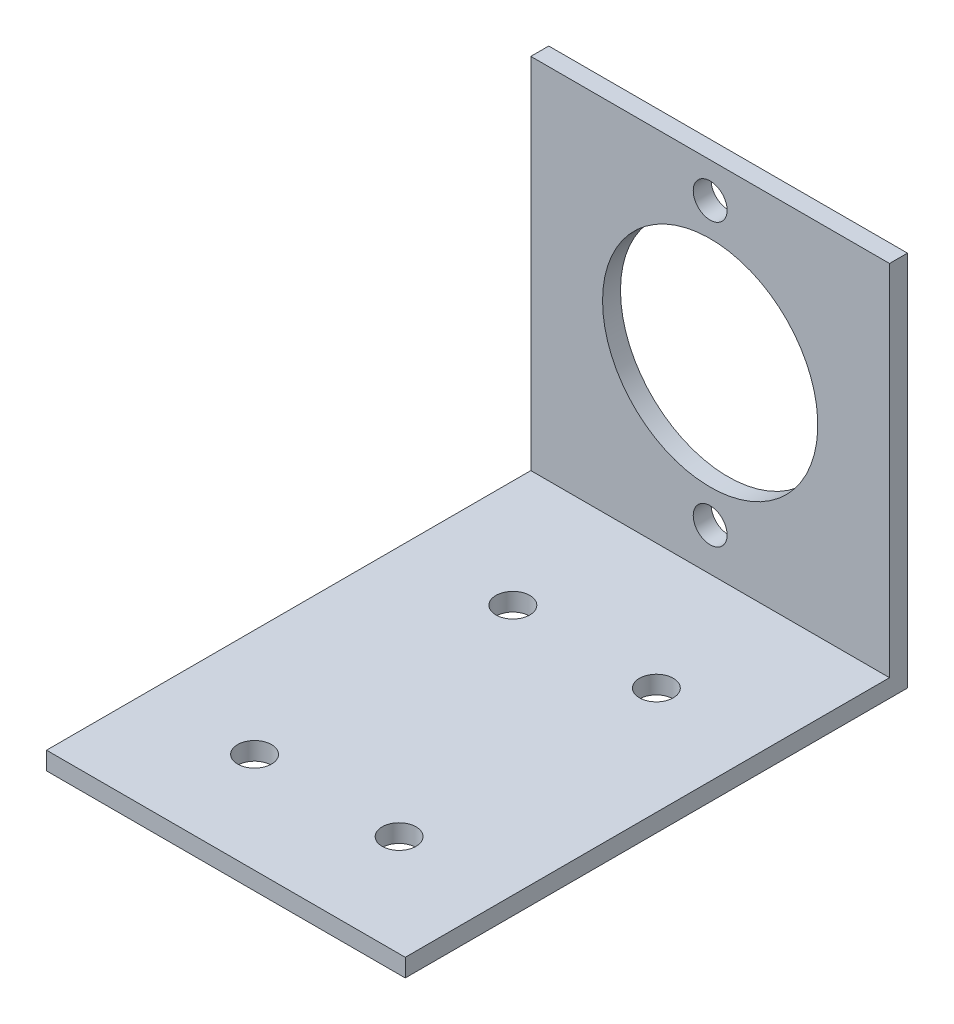
from build123d import *

# Parameters (mm, degrees)
SKETCH1_W                    = 31.75
SKETCH1_H                    = 1.5875
BOSS_EXTRUDE1_DEPTH          = 44.45
SKETCH2_W                    = 31.75
SKETCH2_H                    = 1.5875
BOSS_EXTRUDE2_DEPTH          = 31.75
SKETCH3_R                    = 9.525
CUT_EXTRUDE1_DEPTH           = 64.994170877
F_3_0_3_DIAMETER_HOLE1_D     = 3
F_3_0_3_DIAMETER_HOLE1_DEPTH = 3.556
F_3_0_3_DIAMETER_HOLE1_TIP   = 0.901290929
F_3_0_3_DIAMETER_HOLE2_D     = 3
F_3_0_3_DIAMETER_HOLE2_DEPTH = 3.556
F_3_0_3_DIAMETER_HOLE2_TIP   = 0.901290929


with BuildPart() as part:
    # Sketch1 → Boss-Extrude1 (new body)
    with BuildSketch(Plane.XY):
        with Locations((15.875, 0.79375)):
            Rectangle(SKETCH1_W, SKETCH1_H)
    extrude(amount=BOSS_EXTRUDE1_DEPTH)

    # Sketch2 → Boss-Extrude2 (add)
    with BuildSketch(Plane(origin=(0, 1.5875, 0), x_dir=(1, 0, 0), z_dir=(0, 1, 0))):
        with Locations((15.875, -0.79375)):
            Rectangle(SKETCH2_W, SKETCH2_H)
    extrude(amount=BOSS_EXTRUDE2_DEPTH)

    # Sketch3 → Cut-Extrude1 (cut, through all)
    with BuildSketch(Plane(origin=(0, 0, 0), x_dir=(-1, 0, 0), z_dir=(0, 0, -1))):
        with Locations((-15.875, 17.78)):
            Circle(SKETCH3_R)
    extrude(amount=-CUT_EXTRUDE1_DEPTH, mode=Mode.SUBTRACT)

    # Ø3.0 (3) Diameter Hole1
    with Locations(Plane(origin=(0, 0, 0), x_dir=(-1, 0, 0), z_dir=(0, 0, -1))):
        with Locations((-15.875, 30.226), (-15.875, 5.334)):
            Hole(F_3_0_3_DIAMETER_HOLE1_D / 2, depth=F_3_0_3_DIAMETER_HOLE1_DEPTH)
            with Locations((0, 0, -(F_3_0_3_DIAMETER_HOLE1_DEPTH + F_3_0_3_DIAMETER_HOLE1_TIP / 2))):  # 118° drill point
                Cone(0, F_3_0_3_DIAMETER_HOLE1_D / 2, F_3_0_3_DIAMETER_HOLE1_TIP, mode=Mode.SUBTRACT)

    # Ø3.0 (3) Diameter Hole2
    with Locations(Plane(origin=(0, 1.5875, 0), x_dir=(1, 0, 0), z_dir=(0, 1, 0))):
        with Locations((22.225, -12.7), (22.225, -35.469930371), (9.525, -12.7), (9.525, -35.56)):
            Hole(F_3_0_3_DIAMETER_HOLE2_D / 2, depth=F_3_0_3_DIAMETER_HOLE2_DEPTH)
            with Locations((0, 0, -(F_3_0_3_DIAMETER_HOLE2_DEPTH + F_3_0_3_DIAMETER_HOLE2_TIP / 2))):  # 118° drill point
                Cone(0, F_3_0_3_DIAMETER_HOLE2_D / 2, F_3_0_3_DIAMETER_HOLE2_TIP, mode=Mode.SUBTRACT)


solid = part.part
